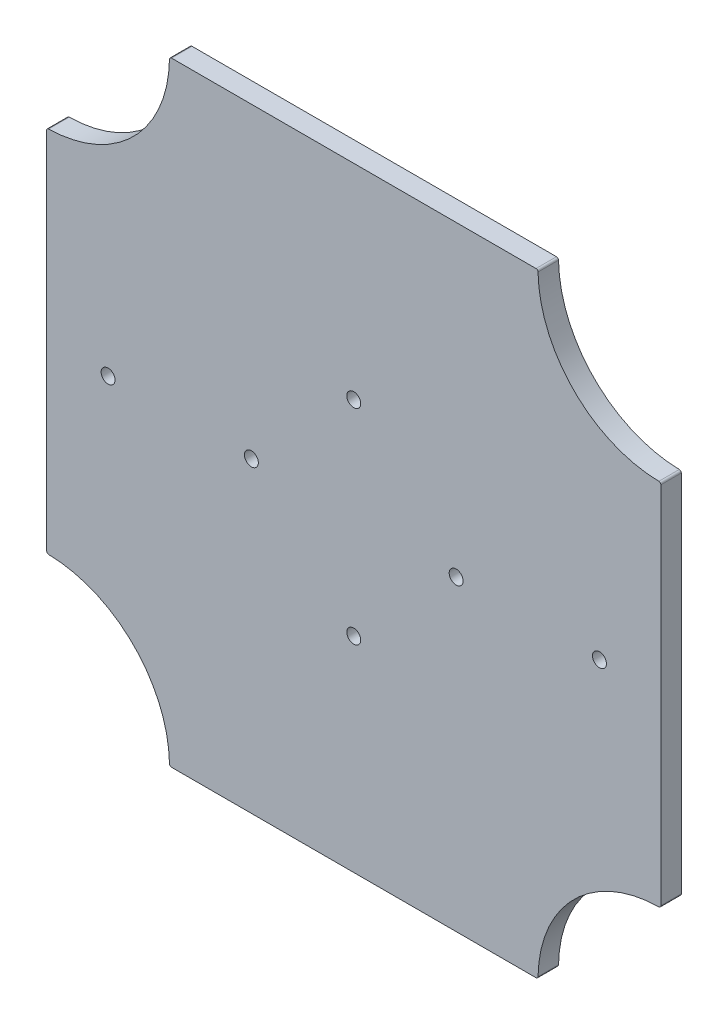
from build123d import *

# Parameters (mm, degrees)
ESQUISSE1_W             = 150
ESQUISSE1_H             = 150
BOSS_EXTRU_1_DEPTH      = 5
ENL_V_MAT_EXTRU_1_DEPTH = 5
D_GAGEMENT_M31_D        = 3.4
CONG_1_R                = 0.5


with BuildPart() as part:
    # Esquisse1 → Boss.-Extru.1 (new body)
    with BuildSketch(Plane.XY):
        Rectangle(ESQUISSE1_W, ESQUISSE1_H)
    extrude(amount=BOSS_EXTRU_1_DEPTH)

    # Esquisse2 → Enlèv. mat.-Extru.1 (cut)
    with BuildSketch(Plane.XY.offset(5)):
        with BuildLine():
            Line((45, 75), (75, 75))
            Line((75, 75), (75, 45))
            ThreePointArc((75, 45), (53.786796564, 53.786796564), (45, 75))
        make_face()
        with BuildLine():
            Line((75, -75), (45, -75))
            ThreePointArc((45, -75), (53.786796564, -53.786796564), (75, -45))
            Line((75, -45), (75, -75))
        make_face()
        with BuildLine():
            Line((-75, -75), (-75, -45))
            ThreePointArc((-75, -45), (-53.786796564, -53.786796564), (-45, -75))
            Line((-45, -75), (-75, -75))
        make_face()
        with BuildLine():
            Line((-75, 75), (-45, 75))
            ThreePointArc((-45, 75), (-53.786796564, 53.786796564), (-75, 45))
            Line((-75, 45), (-75, 75))
        make_face()
    extrude(amount=-ENL_V_MAT_EXTRU_1_DEPTH, mode=Mode.SUBTRACT)

    # Dégagement M31 (through all)
    with Locations(Plane(origin=(0, 0, 0), x_dir=(-1, 0, 0), z_dir=(0, 0, -1))):
        with Locations((0, 25), (0, -25), (60, 0), (25, 0), (-25, 0), (-60, 0)):
            Hole(D_GAGEMENT_M31_D / 2)

    # Congé1
    cong_1_edges = [part.edges().sort_by_distance(p)[0] for p in [
        (-75, 45, 2.5),
        (-45, 75, 2.5),
        (-45, -75, 2.5),
        (-75, -45, 2.5),
        (75, -45, 2.5),
        (45, -75, 2.5),
        (75, 45, 2.5),
        (45, 75, 2.5),
    ]]
    fillet(cong_1_edges, radius=CONG_1_R)


solid = part.part
